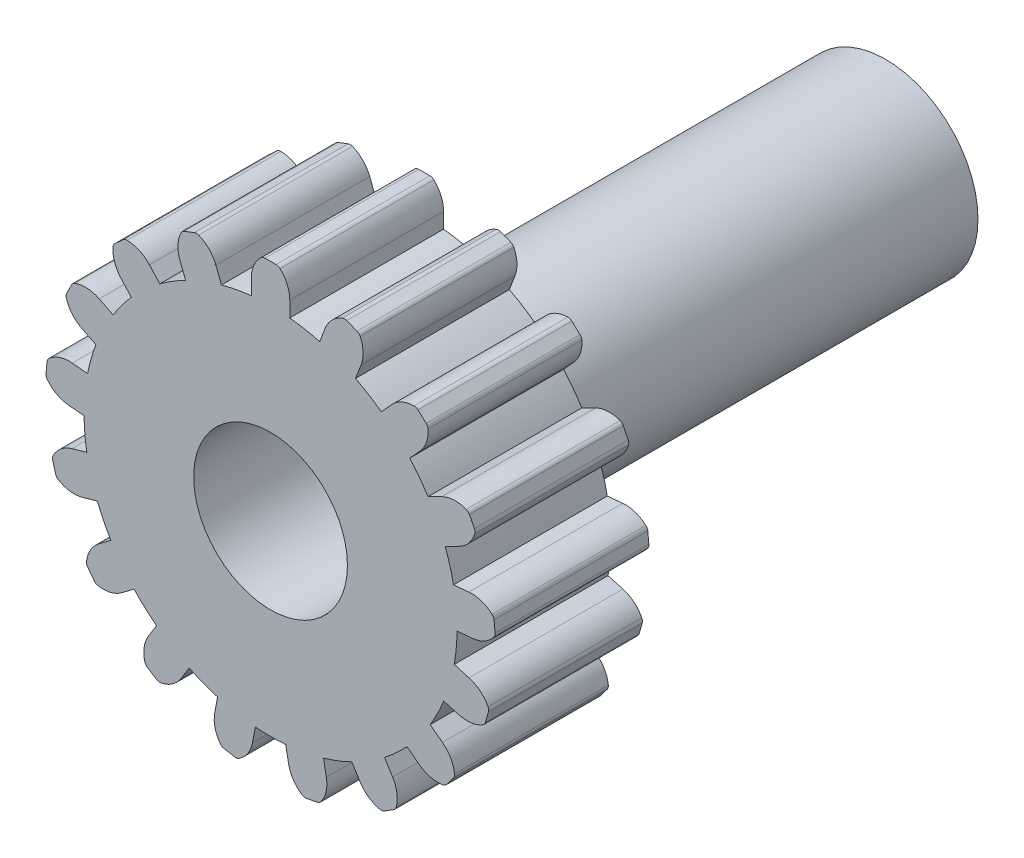
from build123d import *

# Parameters (mm, degrees)
SKETCH1_R           = 24.25521333
BOSS_EXTRUDE1_DEPTH = 10
BOSS_EXTRUDE2_DEPTH = 20
CIRPATTERN1_COUNT   = 17
SKETCH3_R           = 12
CUT_EXTRUDE1_DEPTH  = 20
SKETCH4_R           = 12
SKETCH4_R_2         = 10
BOSS_EXTRUDE3_DEPTH = 80
CUT_EXTRUDE2_START  = -20
CUT_EXTRUDE2_DEPTH  = 20


with BuildPart() as part:
    # Sketch1 → Boss-Extrude1 (new, symmetric)
    with BuildSketch(Plane.XY):
        Circle(SKETCH1_R)
    extrude(amount=BOSS_EXTRUDE1_DEPTH, both=True)

    # Sketch2 → Boss-Extrude2 (add, through all)
    with BuildSketch(Plane.XY.offset(10)):
        with BuildLine():
            Line((2.5, 24.126031039), (2.5, 26.126031039))
            ThreePointArc((2.5, 26.126031039), (2.171151383, 27.721007214), (1.233789603, 29.052714129))
            ThreePointArc((1.233789603, 29.052714129), (0.99677215, 29.202753866), (0.721205098, 29.25521333))
            Line((0.721205098, 29.25521333), (-0.721205098, 29.25521333))
            ThreePointArc((-0.721205098, 29.25521333), (-0.99677215, 29.202753866), (-1.233789603, 29.052714129))
            ThreePointArc((-1.233789603, 29.052714129), (-2.171151383, 27.721007214), (-2.5, 26.126031039))
            Line((-2.5, 26.126031039), (-2.5, 24.126031039))
            ThreePointArc((-2.5, 24.126031039), (0, 24.25521333), (2.5, 24.126031039))
        make_face()
    boss_extrude2 = extrude(amount=-BOSS_EXTRUDE2_DEPTH)

    # CirPattern1: Boss-Extrude2 ×17 about axis
    cirpattern1_axis = Axis((0, 0, 0), (0, 0, 1))
    for i in range(1, CIRPATTERN1_COUNT):
        add(boss_extrude2.rotate(cirpattern1_axis, i * 360 / CIRPATTERN1_COUNT))

    # Sketch3 → Cut-Extrude1 (cut)
    with BuildSketch(Plane.XY.offset(10)):
        Circle(SKETCH3_R)
    extrude(amount=-CUT_EXTRUDE1_DEPTH, mode=Mode.SUBTRACT)

    # Sketch4 → Boss-Extrude3 (add)
    with BuildSketch(Plane.XY.offset(10)):
        Circle(SKETCH4_R)
        Circle(SKETCH4_R_2, mode=Mode.SUBTRACT)
    extrude(amount=-BOSS_EXTRUDE3_DEPTH)

    # Sketch5 → Cut-Extrude2 (cut)
    with BuildSketch(Plane(origin=(0, 0, -70), x_dir=(-1, 0, 0), z_dir=(0, 0, -1)).offset(CUT_EXTRUDE2_START)):
        with BuildLine():
            Line((-10.971006085, 0.760945232), (-10.971006085, -1.239054768))
            Line((-10.971006085, -1.239054768), (-9.922940254, -1.239054768))
            ThreePointArc((-9.922940254, -1.239054768), (-9.997113345, -0.240259783), (-9.971006085, 0.760945232))
            Line((-9.971006085, 0.760945232), (-10.971006085, 0.760945232))
        make_face()
    extrude(amount=CUT_EXTRUDE2_DEPTH, mode=Mode.SUBTRACT)


solid = part.part
